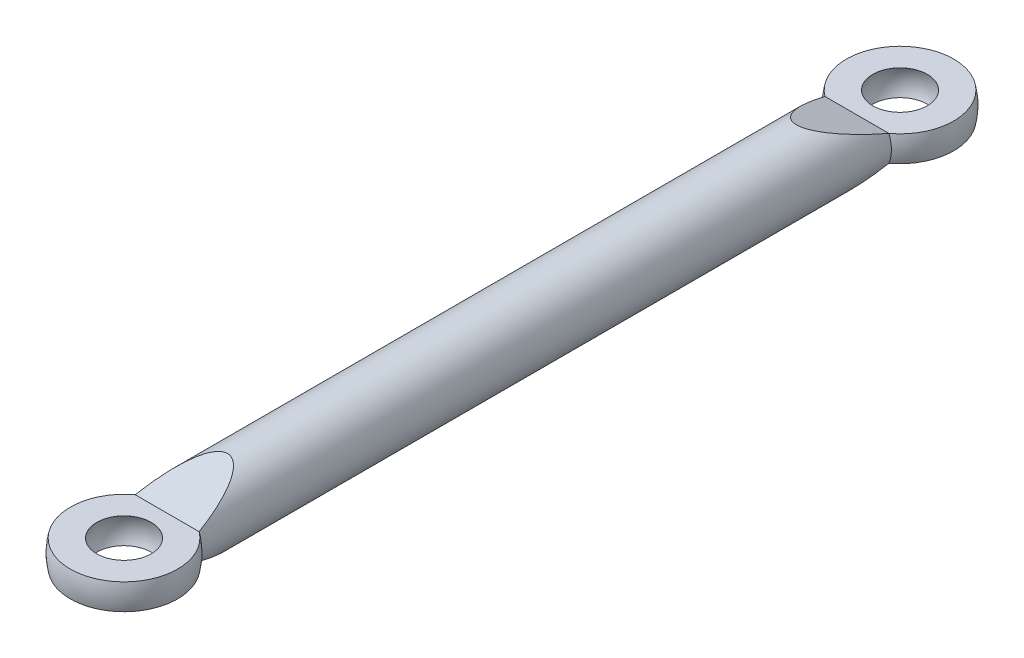
from build123d import *

# Parameters (mm, degrees)
SKETCH_1_R               = 4
EXTRUDE_1_DEPTH          = 40
CUT_EXTRUDE_1_DEPTH      = 53.194647057
CUT_EXTRUDE_1_DEPTH_BACK = 53.194647057


with BuildPart() as part:
    # 草图1 → 凸台-拉伸1 (new, symmetric)
    with BuildSketch(Plane.XY):
        Circle(SKETCH_1_R)
    extrude(amount=EXTRUDE_1_DEPTH, both=True)

    # 草图2 → 旋转2 (revolve)
    with BuildSketch(Plane(origin=(0, 0, 0), x_dir=(1, 0, 0), z_dir=(0, 1, 0))):
        with BuildLine():
            ThreePointArc((0, 38.596875763), (6.403124237, 45), (0, 51.403124237))
            Line((0, 51.403124237), (0, 48.5))
            ThreePointArc((0, 48.5), (3.5, 45), (0, 41.5))
            Line((0, 41.5), (0, 38.596875763))
        make_face()
        with BuildLine():
            Line((0, -48.5), (0, -51.403124237))
            ThreePointArc((0, -51.403124237), (6.403124237, -45), (0, -38.596875763))
            Line((0, -38.596875763), (0, -41.5))
            ThreePointArc((0, -41.5), (3.5, -45), (0, -48.5))
        make_face()
    revolve(axis=Axis((0, 0, -51.403124237), (0, 0, 1)))

    # 草图3 → 切除-拉伸1 (cut, two sides: drawn at the far end of the back side and taken through both)
    with BuildSketch(Plane(origin=(0, 0, 0), x_dir=(0, 0, -1), z_dir=(1, 0, 0)).offset(-CUT_EXTRUDE_1_DEPTH_BACK)):
        Polygon((-33, 4), (-40, 1.5), (-53, 1.5), (-53, 8), (-33, 8), align=None)
        Polygon((-33, -8), (-33, -4), (-40, -1.5), (-53, -1.5), (-53, -8), align=None)
        Polygon((33, -4), (40, -1.5), (53, -1.5), (53, -8), (33, -8), align=None)
        Polygon((33, 8), (33, 4), (40, 1.5), (53, 1.5), (53, 8), align=None)
    extrude(amount=CUT_EXTRUDE_1_DEPTH + CUT_EXTRUDE_1_DEPTH_BACK, mode=Mode.SUBTRACT)


solid = part.part
